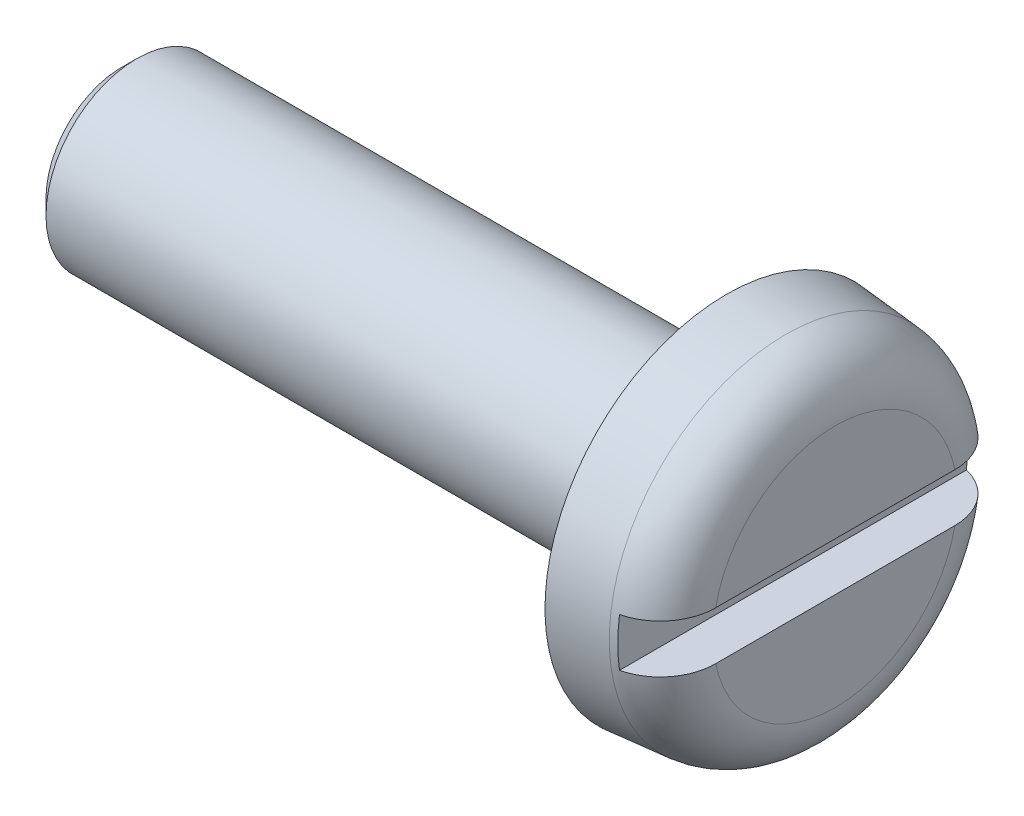
from build123d import *

# Parameters (mm, degrees)
SKETCH2_W          = 11.892854998
SKETCH2_H          = 1.6
CUT_EXTRUDE1_DEPTH = 1.4
CHAMFER1_SIZE      = 0.5


with BuildPart() as part:
    # Sketch1 → Revolve1 (revolve)
    with BuildSketch(Plane.XY):
        with BuildLine():
            Line((0, 0), (0, 4.035644698))
            ThreePointArc((0, 4.035644698), (-0.472900794, 5.251707072), (-1.643119663, 5.828795155))
            Line((-1.643119663, 5.828795155), (-3.6, 6))
            Line((-3.6, 6), (-3.6, 3))
            Line((-3.6, 3), (-23.6, 3))
            Line((-23.6, 3), (-23.6, 0))
            Line((-23.6, 0), (0, 0))
        make_face()
    revolve(axis=Axis((0, 0, 0), (-1, 0, 0)))

    # Sketch2 → Cut-Extrude1 (cut)
    with BuildSketch(Plane(origin=(0, 0, 0), x_dir=(0, 0, -1), z_dir=(1, 0, 0))):
        Rectangle(SKETCH2_W, SKETCH2_H)
    extrude(amount=-CUT_EXTRUDE1_DEPTH, mode=Mode.SUBTRACT)

    # Chamfer1
    chamfer1_edges = [part.edges().sort_by_distance(p)[0] for p in [
        (-23.6, -3, 0),
    ]]
    chamfer(chamfer1_edges, length=CHAMFER1_SIZE)


solid = part.part
